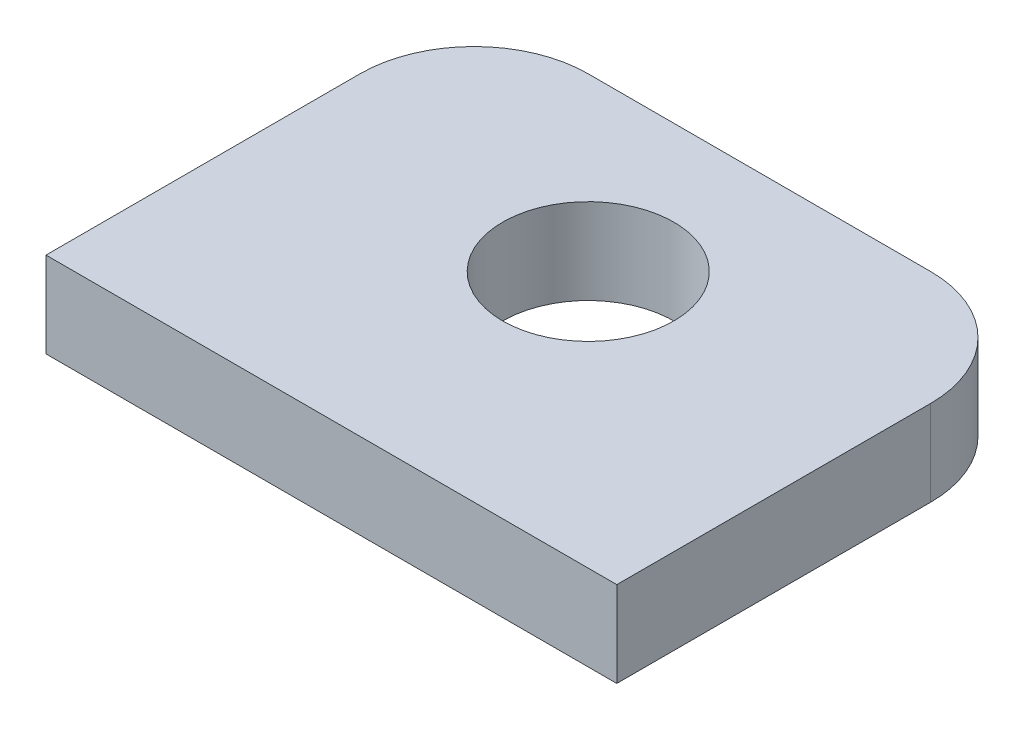
from build123d import *

# Parameters (mm, degrees)
ESBO_O1_R                = 1.5
RESSALTO_EXTRUS_O1_DEPTH = 1.5


with BuildPart() as part:
    # Esboço1 → Ressalto-extrusão1 (new body)
    with BuildSketch(Plane(origin=(0, 0, 0), x_dir=(1, 0, 0), z_dir=(0, 1, 0))):
        with BuildLine():
            Line((-5, -3.75), (-5, 1.75))
            ThreePointArc((-5, 1.75), (-4.414213562, 3.164213562), (-3, 3.75))
            Line((-3, 3.75), (3, 3.75))
            ThreePointArc((3, 3.75), (4.414213562, 3.164213562), (5, 1.75))
            Line((5, 1.75), (5, -3.75))
            Line((5, -3.75), (-5, -3.75))
        make_face()
        with Locations(Location((0, 0.75, 0), (0, 0, 270))):
            Circle(ESBO_O1_R, mode=Mode.SUBTRACT)
    extrude(amount=RESSALTO_EXTRUS_O1_DEPTH)


solid = part.part
